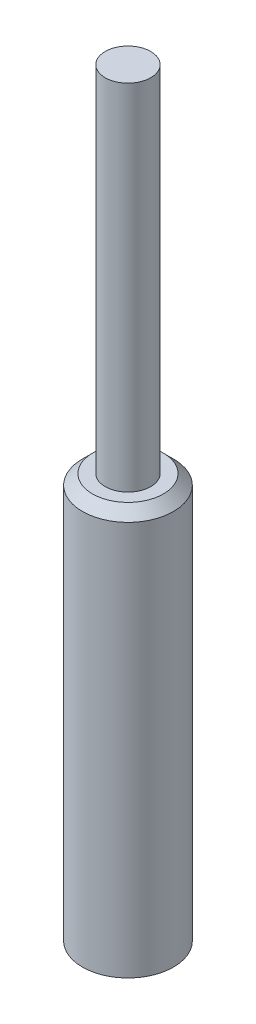
from build123d import *

# Parameters (mm, degrees)
CHAMFER_1_SIZE = 0.2


with BuildPart() as part:
    # Эскиз1 → Повернуть1 (revolve)
    with BuildSketch(Plane.XY, mode=Mode.PRIVATE) as revolve_1_sk:
        Polygon((0, 0), (-0.9, 0), (-0.9, 8), (-0.45, 8), (-0.45, 15), (0, 15), align=None)
    revolve(revolve_1_sk.sketch.rotate(Axis((0, 0, 0), (0, -1, 0)), 270), axis=Axis((0, 0, 0), (0, -1, 0)))

    # Фаска1
    chamfer_1_edges = [part.edges().sort_by_distance(p)[0] for p in [
        (0, 8, -0.9),
    ]]
    chamfer(chamfer_1_edges, length=CHAMFER_1_SIZE)


solid = part.part
